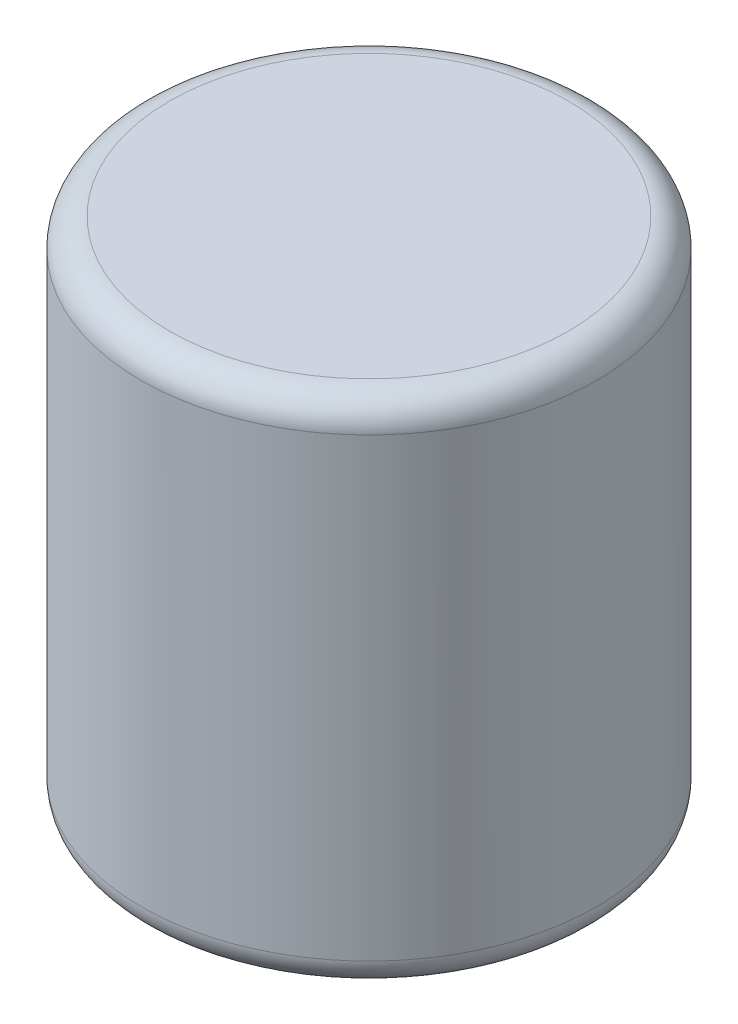
from build123d import *

# Parameters (mm, degrees)
FILLET1_R = 1


with BuildPart() as part:
    # Sketch1 → Revolve1 (revolve)
    with BuildSketch(Plane.XY, mode=Mode.PRIVATE) as revolve1_sk:
        Polygon((0, 18), (8, 18), (8, 0), (6.2, 0), (6.2, 0.75), (6.5, 0.75), (6.5, 14.5), (6.2, 14.5), (6.2, 15.25), (5.5, 15.25), (5.5, 16.5), (0, 16.5), align=None)
    revolve(revolve1_sk.sketch.rotate(Axis((0, 0, 0), (0, 1, 0)), 90), axis=Axis((0, 0, 0), (0, 1, 0)))

    # Fillet1
    fillet1_edges = [part.edges().sort_by_distance(p)[0] for p in [
        (0, 0, 8),
        (0, 18, 8),
    ]]
    fillet(fillet1_edges, radius=FILLET1_R)


solid = part.part
